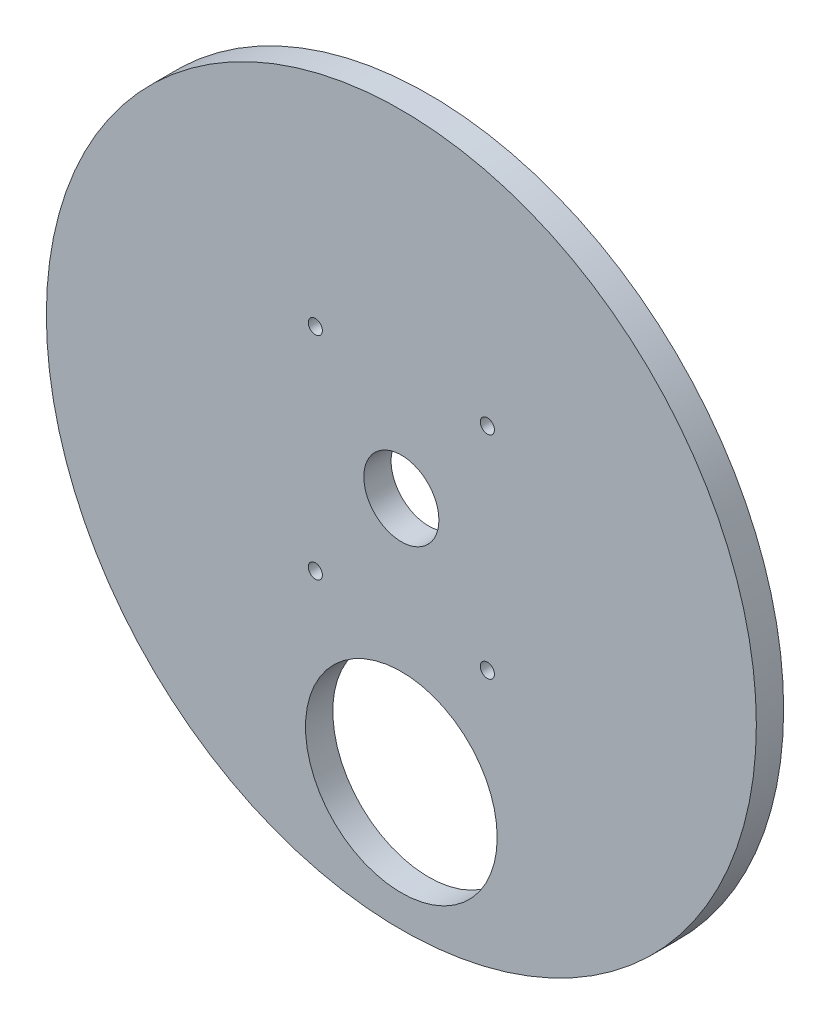
from build123d import *

# Parameters (mm, degrees)
SKETCH1_R                                = 165.1
SKETCH1_R_2                              = 44.577
SKETCH1_R_3                              = 17.4625
BOSS_EXTRUDE1_DEPTH                      = 12.7
CBORE_FOR_1_4_HEX_HEAD_BOLT1_D           = 6.5786
CBORE_FOR_1_4_HEX_HEAD_BOLT1_CBORE_D     = 12.7
CBORE_FOR_1_4_HEX_HEAD_BOLT1_CBORE_DEPTH = 3.81


with BuildPart() as part:
    # Sketch1 → Boss-Extrude1 (new body)
    with BuildSketch(Plane.XY):
        with Locations((0, -8.643025507)):
            Circle(SKETCH1_R)
        with Locations((0, -114.3)):
            Circle(SKETCH1_R_2, mode=Mode.SUBTRACT)
        Circle(SKETCH1_R_3, mode=Mode.SUBTRACT)
    extrude(amount=BOSS_EXTRUDE1_DEPTH)

    # CBORE for 1/4 Hex Head Bolt1 (through all)
    with Locations(Plane(origin=(0, 0, 0), x_dir=(-1, 0, 0), z_dir=(0, 0, -1))):
        with Locations((-40.005, 49.2125), (40.005, 49.2125), (40.005, -49.2125), (-40.005, -49.2125)):
            CounterBoreHole(CBORE_FOR_1_4_HEX_HEAD_BOLT1_D / 2, CBORE_FOR_1_4_HEX_HEAD_BOLT1_CBORE_D / 2, CBORE_FOR_1_4_HEX_HEAD_BOLT1_CBORE_DEPTH)


solid = part.part
